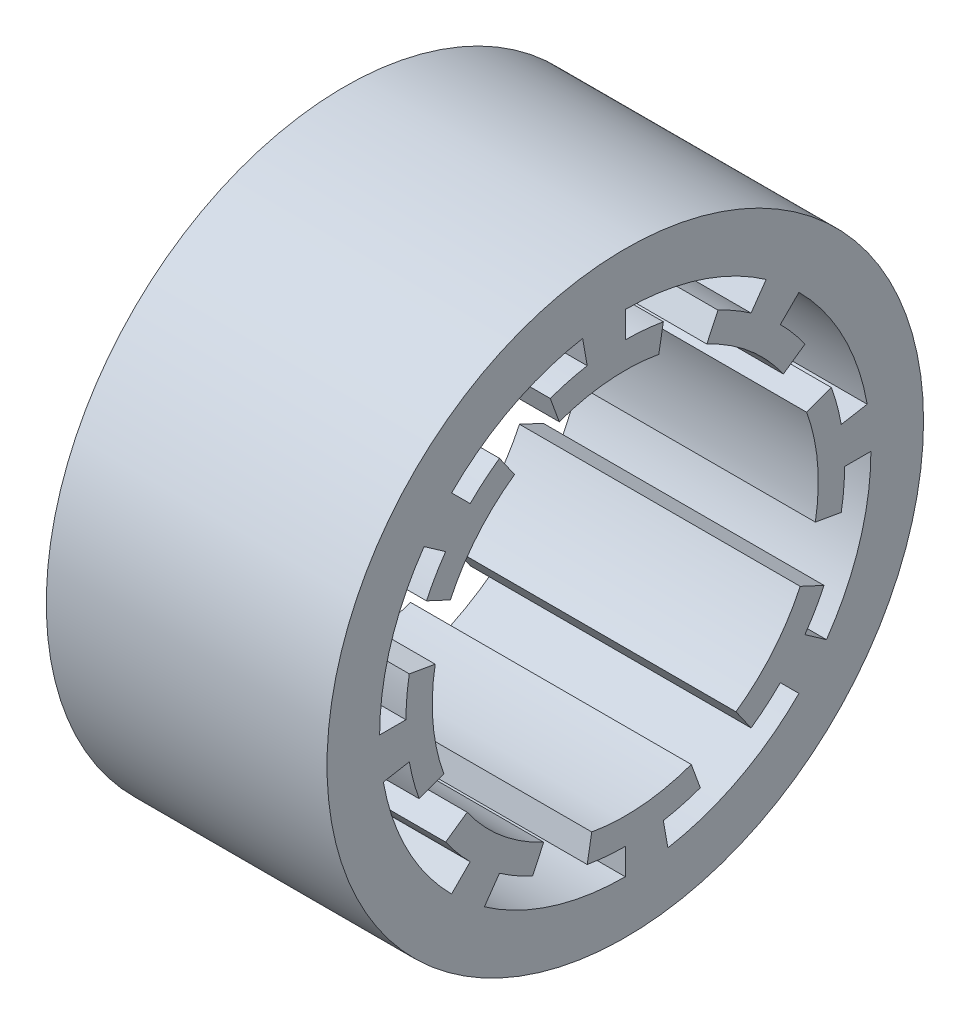
from build123d import *

# Parameters (mm, degrees)
SKETCH1_R           = 21.59
SKETCH1_R_2         = 17.78
BOSS_EXTRUDE1_DEPTH = 20.32
BOSS_EXTRUDE2_DEPTH = 20.32
CIRPATTERN1_COUNT   = 8


with BuildPart() as part:
    # Sketch1 → Boss-Extrude1 (new body)
    with BuildSketch(Plane.YZ):
        with Locations(Location((0, 0, 0), (0, 0, 270))):
            Circle(SKETCH1_R)
        with Locations(Location((0, 0, 0), (0, 0, 270))):
            Circle(SKETCH1_R_2, mode=Mode.SUBTRACT)
    extrude(amount=BOSS_EXTRUDE1_DEPTH)

    # Sketch3 → Boss-Extrude2 (add)
    with BuildSketch(Plane.YZ):
        with BuildLine():
            Line((-3.087464599, 17.509881849), (-2.75666482, 15.633823079))
            ThreePointArc((-2.75666482, 15.633823079), (-4.108752341, 15.334072492), (-5.429569775, 14.917620355))
            Line((-5.429569775, 14.917620355), (-4.778021402, 13.127505912))
            ThreePointArc((-4.778021402, 13.127505912), (-1.217565726, 13.916839932), (2.425865042, 13.75776431))
            Line((2.425865042, 13.75776431), (2.75666482, 15.633823079))
            ThreePointArc((2.75666482, 15.633823079), (1.383597416, 15.814590832), (0, 15.875))
            Line((0, 15.875), (0, 17.78))
            ThreePointArc((0, 17.78), (-1.549629106, 17.712341732), (-3.087464599, 17.509881849))
        make_face()
    boss_extrude2 = extrude(amount=BOSS_EXTRUDE2_DEPTH)

    # CirPattern1: Boss-Extrude2 ×8 about axis
    cirpattern1_axis = Axis((0, 0, 0), (1, 0, 0))
    for i in range(1, CIRPATTERN1_COUNT):
        add(boss_extrude2.rotate(cirpattern1_axis, i * 360 / CIRPATTERN1_COUNT))


solid = part.part
